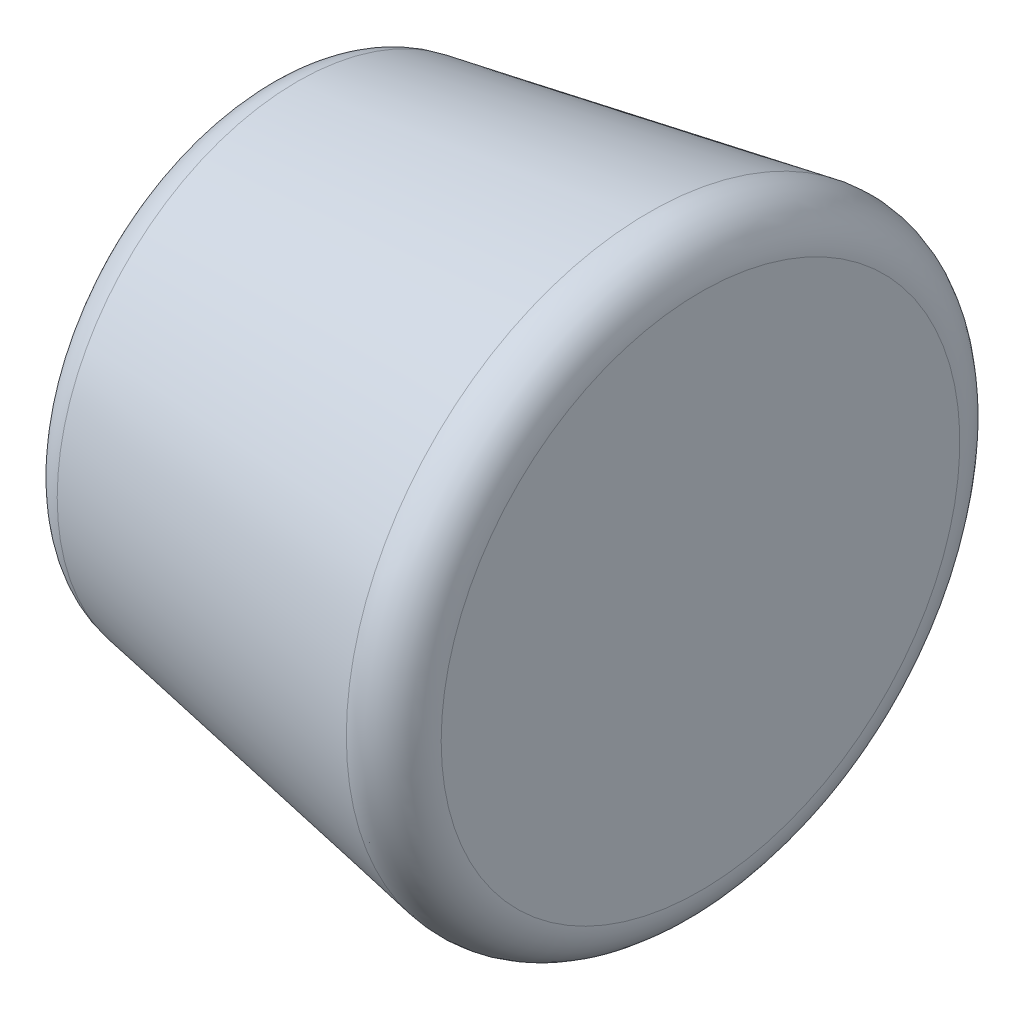
from build123d import *

# Parameters (mm, degrees)
SKETCH1_W = 10
SKETCH1_H = 5.323
FILLET1_R = 1


with BuildPart() as part:
    # Sketch1 → Revolve1 (revolve)
    with BuildSketch(Plane.XY, mode=Mode.PRIVATE) as revolve1_sk:
        with Locations((5, 2.6615)):
            Rectangle(SKETCH1_W, SKETCH1_H)
        Polygon((10, 7.096), (0, 5.323), (10, 5.323), align=None)
    revolve(revolve1_sk.sketch.rotate(Axis((10, 0, 0), (-1, 0, 0)), 90), axis=Axis((10, 0, 0), (-1, 0, 0)))

    # Fillet1
    fillet1_edges = [part.edges().sort_by_distance(p)[0] for p in [
        (0, 0, 5.323),
        (10, 0, 7.096),
    ]]
    fillet(fillet1_edges, radius=FILLET1_R)


solid = part.part
